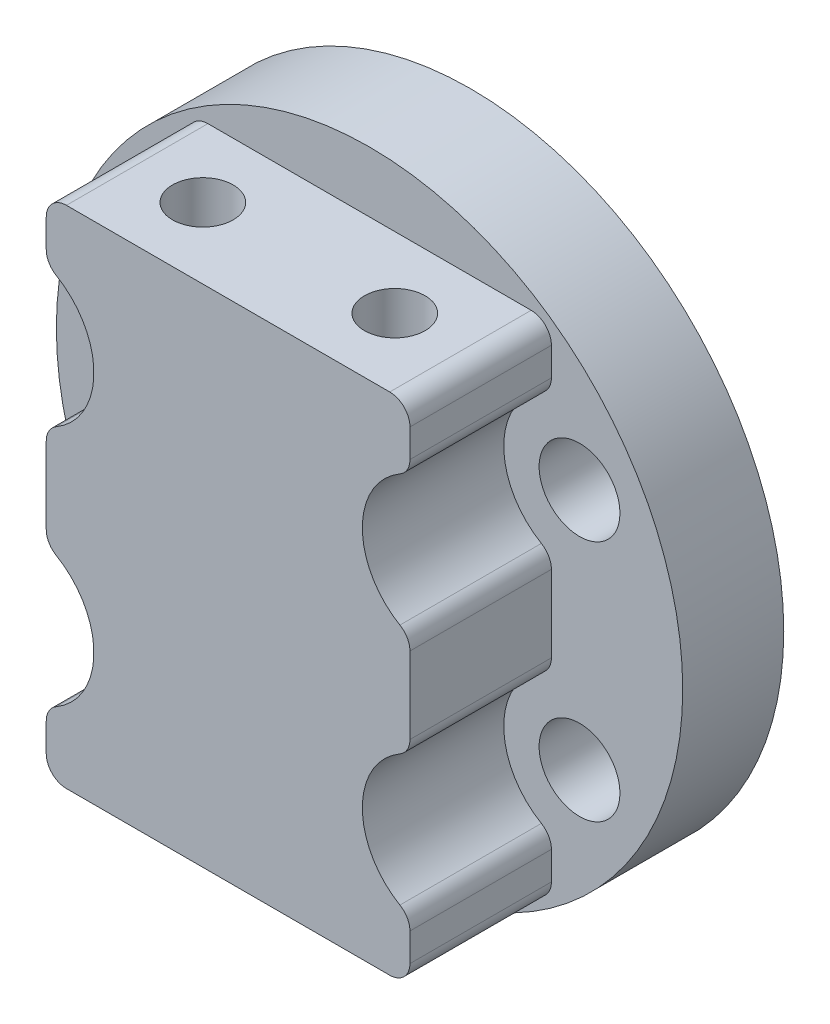
from build123d import *

# Parameters (mm, degrees)
SKETCH_1_R          = 15.5
SKETCH_1_R_2        = 2
EXTRUDE_1_DEPTH     = 3
FILLET_1_R          = 3
SKETCH_5_R          = 15.5
SKETCH_5_R_2        = 2
EXTRUDE_3_DEPTH     = 2
EXTRUDE_5_DEPTH     = 7
FILLET_4_R          = 1
SKETCH_8_R          = 1.5
CUT_EXTRUDE_3_DEPTH = 35.179672449


with BuildPart() as part:
    # 草图1 → 凸台-拉伸1 (new body)
    with BuildSketch(Plane.XY):
        Circle(SKETCH_1_R)
        with Locations((-10.392304845, -6)):
            Circle(SKETCH_1_R_2, mode=Mode.SUBTRACT)
        with Locations((10.392304845, -6)):
            Circle(SKETCH_1_R_2, mode=Mode.SUBTRACT)
        with Locations((-10.392304845, 6)):
            Circle(SKETCH_1_R_2, mode=Mode.SUBTRACT)
        with BuildLine():
            ThreePointArc((2.604308084, 8.091203829), (5.825, 10.089195954), (5.705034021, 6.300998875))
            ThreePointArc((5.705034021, 6.300998875), (8.5, 0), (5.705034021, -6.300998875))
            ThreePointArc((5.705034021, -6.300998875), (5.825, -10.089195954), (2.604308084, -8.091203829))
            ThreePointArc((2.604308084, -8.091203829), (-4.25, -7.361215932), (-8.309342105, -1.790204954))
            ThreePointArc((-8.309342105, -1.790204954), (-11.65, 0), (-8.309342105, 1.790204954))
            ThreePointArc((-8.309342105, 1.790204954), (-4.25, 7.361215932), (2.604308084, 8.091203829))
        make_face(mode=Mode.SUBTRACT)
        with Locations((10.392304845, 6)):
            Circle(SKETCH_1_R_2, mode=Mode.SUBTRACT)
    extrude(amount=EXTRUDE_1_DEPTH)

    # 圆角1
    fillet_1_edges = [part.edges().sort_by_distance(p)[0] for p in [
        (-8.309342105, 1.790204954, 1.5),
        (-8.309342105, -1.790204954, 1.5),
        (2.604308084, -8.091203829, 1.5),
        (5.705034021, -6.300998875, 1.5),
        (5.705034021, 6.300998875, 1.5),
        (2.604308084, 8.091203829, 1.5),
    ]]
    fillet(fillet_1_edges, radius=FILLET_1_R)

    # 草图5 → 凸台-拉伸3 (add)
    with BuildSketch(Plane.XY.offset(3)):
        Circle(SKETCH_5_R)
        with Locations((-10.392304845, -6)):
            Circle(SKETCH_5_R_2, mode=Mode.SUBTRACT)
        with Locations((10.392304845, -6)):
            Circle(SKETCH_5_R_2, mode=Mode.SUBTRACT)
        with Locations((10.392304845, 6)):
            Circle(SKETCH_5_R_2, mode=Mode.SUBTRACT)
        with Locations((-10.392304845, 6)):
            Circle(SKETCH_5_R_2, mode=Mode.SUBTRACT)
    extrude(amount=EXTRUDE_3_DEPTH)

    # 草图7 → 凸台-拉伸5 (add)
    with BuildSketch(Plane.XY.offset(5)):
        with BuildLine():
            Line((9, 12.5), (-9, 12.5))
            Line((-9, 12.5), (-9, 9.481951639))
            ThreePointArc((-9, 9.481951639), (-7.287176573, 8.102540942), (-6.642304845, 6))
            ThreePointArc((-6.642304845, 6), (-7.287176573, 3.897459058), (-9, 2.518048361))
            Line((-9, 2.518048361), (-9, -2.518048361))
            ThreePointArc((-9, -2.518048361), (-7.287176573, -3.897459058), (-6.642304845, -6))
            ThreePointArc((-6.642304845, -6), (-7.287176573, -8.102540942), (-9, -9.481951639))
            Line((-9, -9.481951639), (-9, -12.5))
            Line((-9, -12.5), (9, -12.5))
            Line((9, -12.5), (9, -9.481951639))
            ThreePointArc((9, -9.481951639), (6.642304845, -6), (9, -2.518048361))
            Line((9, -2.518048361), (9, 2.518048361))
            ThreePointArc((9, 2.518048361), (6.642304845, 6), (9, 9.481951639))
            Line((9, 9.481951639), (9, 12.5))
        make_face()
    extrude(amount=EXTRUDE_5_DEPTH)

    # 圆角4
    fillet_4_edges = [part.edges().sort_by_distance(p)[0] for p in [
        (9, -9.481951639, 8.5),
        (9, -2.518048361, 8.5),
        (9, 2.518048361, 8.5),
        (9, 9.481951639, 8.5),
        (9, 12.5, 8.5),
        (-9, 12.5, 8.5),
        (-9, 9.481951639, 8.5),
        (-9, 2.518048361, 8.5),
        (-9, -2.518048361, 8.5),
        (-9, -9.481951639, 8.5),
        (-9, -12.5, 8.5),
        (9, -12.5, 8.5),
    ]]
    fillet(fillet_4_edges, radius=FILLET_4_R)

    # 草图8 → 切除-拉伸3 (cut, through all)
    with BuildSketch(Plane(origin=(0, 12.5, 0), x_dir=(1, 0, 0), z_dir=(0, 1, 0))):
        with Locations(Location((-4.75, -8.5, 0), (0, 0, 270))):
            Circle(SKETCH_8_R)
        with Locations(Location((4.75, -8.5, 0), (0, 0, 270))):
            Circle(SKETCH_8_R)
    extrude(amount=-CUT_EXTRUDE_3_DEPTH, mode=Mode.SUBTRACT)


solid = part.part
